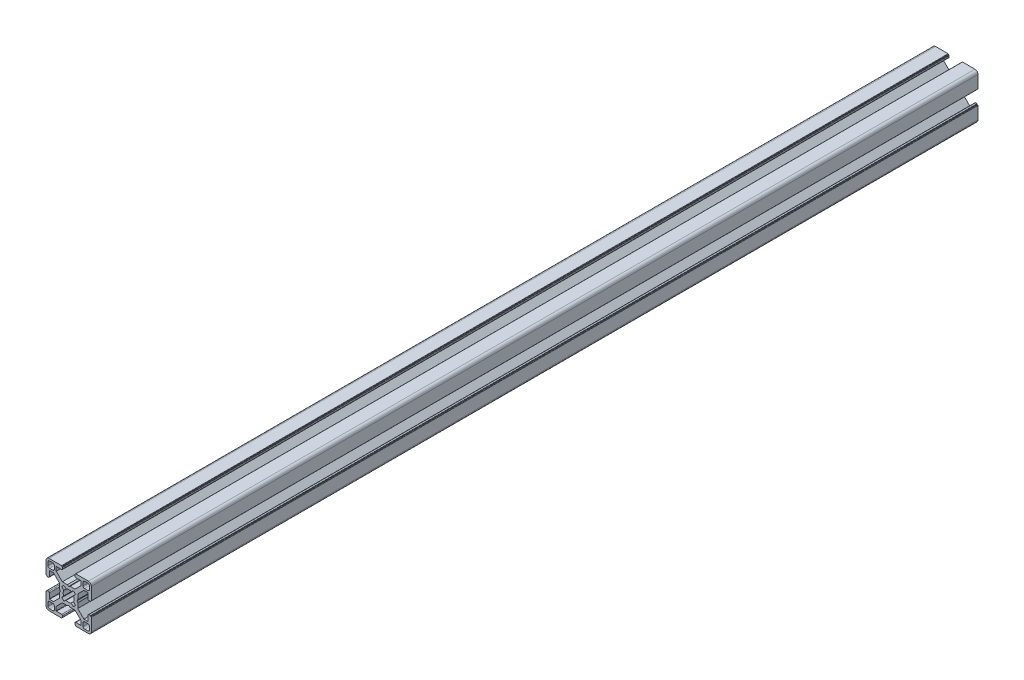
from build123d import *

# Parameters (mm, degrees)
BOSS_EXTRUDE1_DEPTH = 586.105


with BuildPart() as part:
    # Sketch1 → Boss-Extrude1 (new body)
    with BuildSketch(Plane.XY):
        with BuildLine():
            Line((6.00446543, 0.899999619), (5.484852164, 0))
            Line((5.484852164, 0), (6.00446543, -0.899999619))
            Line((6.00446543, -0.899999619), (6.00446543, -4.204465866))
            Line((6.00446543, -4.204465866), (10.049999564, -8.25))
            Line((10.049999564, -8.25), (12.59999928, -8.25))
            ThreePointArc((12.59999928, -8.25), (12.741420837, -8.191421273), (12.799999564, -8.049999716))
            Line((12.799999564, -8.049999716), (12.799999564, -4.649999613))
            ThreePointArc((12.799999564, -4.649999613), (12.975735606, -4.225735278), (13.39999994, -4.049999237))
            Line((13.39999994, -4.049999237), (14.300000043, -4.049999237))
            ThreePointArc((14.300000043, -4.049999237), (14.4414216, -4.108577964), (14.500000327, -4.249999521))
            Line((14.500000327, -4.249999521), (14.500000327, -4.349998953))
            ThreePointArc((14.500000327, -4.349998953), (14.558579054, -4.49142051), (14.700000611, -4.549999237))
            Line((14.700000611, -4.549999237), (14.799999716, -4.549999237))
            ThreePointArc((14.799999716, -4.549999237), (14.941421273, -4.608577964), (15, -4.749999521))
            Line((15, -4.749999521), (15, -13.000000346))
            ThreePointArc((15, -13.000000346), (14.414213664, -14.414213664), (13.000000346, -15))
            Line((13.000000346, -15), (4.749999945, -15))
            ThreePointArc((4.749999945, -15), (4.60857832, -14.941421245), (4.549999564, -14.799999619))
            Line((4.549999564, -14.799999619), (4.549999564, -14.69999942))
            ThreePointArc((4.549999564, -14.69999942), (4.49142109, -14.558578474), (4.350000144, -14.5))
            Line((4.350000144, -14.5), (4.250000374, -14.5))
            ThreePointArc((4.250000374, -14.5), (4.108578753, -14.441421247), (4.05, -14.299999626))
            Line((4.05, -14.299999626), (4.05, -13.399999434))
            ThreePointArc((4.05, -13.399999434), (4.225735989, -12.975735226), (4.650000197, -12.799999237))
            Line((4.650000197, -12.799999237), (8.049999924, -12.799999237))
            ThreePointArc((8.049999924, -12.799999237), (8.191421565, -12.741420475), (8.250000327, -12.599998834))
            Line((8.250000327, -12.599998834), (8.250000327, -10.049999237))
            Line((8.250000327, -10.049999237), (4.204466193, -6))
            Line((4.204466193, -6), (0.899999946, -6))
            Line((0.899999946, -6), (0, -5.484851837))
            Line((0, -5.484851837), (-0.899999946, -6))
            Line((-0.899999946, -6), (-4.204466193, -6))
            Line((-4.204466193, -6), (-8.250000327, -10.049999237))
            Line((-8.250000327, -10.049999237), (-8.250000327, -12.599998834))
            ThreePointArc((-8.250000327, -12.599998834), (-8.191421565, -12.741420475), (-8.049999924, -12.799999237))
            Line((-8.049999924, -12.799999237), (-4.650000197, -12.799999237))
            ThreePointArc((-4.650000197, -12.799999237), (-4.225735989, -12.975735226), (-4.05, -13.399999434))
            Line((-4.05, -13.399999434), (-4.05, -14.299999626))
            ThreePointArc((-4.05, -14.299999626), (-4.108578753, -14.441421247), (-4.250000374, -14.5))
            Line((-4.250000374, -14.5), (-4.350000144, -14.5))
            ThreePointArc((-4.350000144, -14.5), (-4.49142109, -14.558578474), (-4.549999564, -14.69999942))
            Line((-4.549999564, -14.69999942), (-4.549999564, -14.799999619))
            ThreePointArc((-4.549999564, -14.799999619), (-4.60857832, -14.941421245), (-4.749999945, -15))
            Line((-4.749999945, -15), (-13.000000346, -15))
            ThreePointArc((-13.000000346, -15), (-14.414213664, -14.414213664), (-15, -13.000000346))
            Line((-15, -13.000000346), (-15, -4.749999521))
            ThreePointArc((-15, -4.749999521), (-14.941421273, -4.608577964), (-14.799999716, -4.549999237))
            Line((-14.799999716, -4.549999237), (-14.700000611, -4.549999237))
            ThreePointArc((-14.700000611, -4.549999237), (-14.558579054, -4.49142051), (-14.500000327, -4.349998953))
            Line((-14.500000327, -4.349998953), (-14.500000327, -4.249999521))
            ThreePointArc((-14.500000327, -4.249999521), (-14.4414216, -4.108577964), (-14.300000043, -4.049999237))
            Line((-14.300000043, -4.049999237), (-13.39999994, -4.049999237))
            ThreePointArc((-13.39999994, -4.049999237), (-12.975735606, -4.225735278), (-12.799999564, -4.649999613))
            Line((-12.799999564, -4.649999613), (-12.799999564, -8.049999716))
            ThreePointArc((-12.799999564, -8.049999716), (-12.741420837, -8.191421273), (-12.59999928, -8.25))
            Line((-12.59999928, -8.25), (-10.049999564, -8.25))
            Line((-10.049999564, -8.25), (-6.00446543, -4.204465866))
            Line((-6.00446543, -4.204465866), (-6.00446543, -0.899999619))
            Line((-6.00446543, -0.899999619), (-5.484852164, 0))
            Line((-5.484852164, 0), (-6.00446543, 0.899999619))
            Line((-6.00446543, 0.899999619), (-6.00446543, 4.204465866))
            Line((-6.00446543, 4.204465866), (-10.049999564, 8.25))
            Line((-10.049999564, 8.25), (-12.59999928, 8.25))
            ThreePointArc((-12.59999928, 8.25), (-12.741420837, 8.191421273), (-12.799999564, 8.049999716))
            Line((-12.799999564, 8.049999716), (-12.799999564, 4.649999613))
            ThreePointArc((-12.799999564, 4.649999613), (-12.975735606, 4.225735278), (-13.39999994, 4.049999237))
            Line((-13.39999994, 4.049999237), (-14.300000043, 4.049999237))
            ThreePointArc((-14.300000043, 4.049999237), (-14.4414216, 4.108577964), (-14.500000327, 4.249999521))
            Line((-14.500000327, 4.249999521), (-14.500000327, 4.349998953))
            ThreePointArc((-14.500000327, 4.349998953), (-14.558579054, 4.49142051), (-14.700000611, 4.549999237))
            Line((-14.700000611, 4.549999237), (-14.799999716, 4.549999237))
            ThreePointArc((-14.799999716, 4.549999237), (-14.941421273, 4.608577964), (-15, 4.749999521))
            Line((-15, 4.749999521), (-15, 13.000000346))
            ThreePointArc((-15, 13.000000346), (-14.414213664, 14.414213664), (-13.000000346, 15))
            Line((-13.000000346, 15), (-4.749999945, 15))
            ThreePointArc((-4.749999945, 15), (-4.60857832, 14.941421245), (-4.549999564, 14.799999619))
            Line((-4.549999564, 14.799999619), (-4.549999564, 14.69999942))
            ThreePointArc((-4.549999564, 14.69999942), (-4.49142109, 14.558578474), (-4.350000144, 14.5))
            Line((-4.350000144, 14.5), (-4.250000374, 14.5))
            ThreePointArc((-4.250000374, 14.5), (-4.108578753, 14.441421247), (-4.05, 14.299999626))
            Line((-4.05, 14.299999626), (-4.05, 13.399999434))
            ThreePointArc((-4.05, 13.399999434), (-4.225735989, 12.975735226), (-4.650000197, 12.799999237))
            Line((-4.650000197, 12.799999237), (-8.049999924, 12.799999237))
            ThreePointArc((-8.049999924, 12.799999237), (-8.191421565, 12.741420475), (-8.250000327, 12.599998834))
            Line((-8.250000327, 12.599998834), (-8.250000327, 10.049999237))
            Line((-8.250000327, 10.049999237), (-4.204466193, 6))
            Line((-4.204466193, 6), (-0.899999946, 6))
            Line((-0.899999946, 6), (0, 5.484851837))
            Line((0, 5.484851837), (0.899999946, 6))
            Line((0.899999946, 6), (4.204466193, 6))
            Line((4.204466193, 6), (8.250000327, 10.049999237))
            Line((8.250000327, 10.049999237), (8.250000327, 12.599998834))
            ThreePointArc((8.250000327, 12.599998834), (8.191421565, 12.741420475), (8.049999924, 12.799999237))
            Line((8.049999924, 12.799999237), (4.650000197, 12.799999237))
            ThreePointArc((4.650000197, 12.799999237), (4.225735989, 12.975735226), (4.05, 13.399999434))
            Line((4.05, 13.399999434), (4.05, 14.299999626))
            ThreePointArc((4.05, 14.299999626), (4.108578753, 14.441421247), (4.250000374, 14.5))
            Line((4.250000374, 14.5), (4.350000144, 14.5))
            ThreePointArc((4.350000144, 14.5), (4.49142109, 14.558578474), (4.549999564, 14.69999942))
            Line((4.549999564, 14.69999942), (4.549999564, 14.799999619))
            ThreePointArc((4.549999564, 14.799999619), (4.60857832, 14.941421245), (4.749999945, 15))
            Line((4.749999945, 15), (13.000000346, 15))
            ThreePointArc((13.000000346, 15), (14.414213664, 14.414213664), (15, 13.000000346))
            Line((15, 13.000000346), (15, 4.749999521))
            ThreePointArc((15, 4.749999521), (14.941421273, 4.608577964), (14.799999716, 4.549999237))
            Line((14.799999716, 4.549999237), (14.700000611, 4.549999237))
            ThreePointArc((14.700000611, 4.549999237), (14.558579054, 4.49142051), (14.500000327, 4.349998953))
            Line((14.500000327, 4.349998953), (14.500000327, 4.249999521))
            ThreePointArc((14.500000327, 4.249999521), (14.4414216, 4.108577964), (14.300000043, 4.049999237))
            Line((14.300000043, 4.049999237), (13.39999994, 4.049999237))
            ThreePointArc((13.39999994, 4.049999237), (12.975735606, 4.225735278), (12.799999564, 4.649999613))
            Line((12.799999564, 4.649999613), (12.799999564, 8.049999716))
            ThreePointArc((12.799999564, 8.049999716), (12.741420837, 8.191421273), (12.59999928, 8.25))
            Line((12.59999928, 8.25), (10.049999564, 8.25))
            Line((10.049999564, 8.25), (6.00446543, 4.204465866))
            Line((6.00446543, 4.204465866), (6.00446543, 0.899999619))
        make_face()
        with BuildLine():
            Line((13.70000109, 12.700000398), (13.70000109, 10.499999635))
            ThreePointArc((13.70000109, 10.499999635), (13.407107874, 9.792892851), (12.70000109, 9.499999635))
            Line((12.70000109, 9.499999635), (10.500000327, 9.499999635))
            ThreePointArc((10.500000327, 9.499999635), (9.792893543, 9.792892851), (9.500000327, 10.499999635))
            Line((9.500000327, 10.499999635), (9.500000327, 12.700000398))
            ThreePointArc((9.500000327, 12.700000398), (9.792893543, 13.407107182), (10.500000327, 13.700000398))
            Line((10.500000327, 13.700000398), (12.70000109, 13.700000398))
            ThreePointArc((12.70000109, 13.700000398), (13.407107874, 13.407107182), (13.70000109, 12.700000398))
        make_face(mode=Mode.SUBTRACT)
        with BuildLine():
            Line((3.135929412, 4.518400903), (1.600129524, 3.280561767))
            ThreePointArc((1.600129524, 3.280561767), (0, 3.65), (-1.600129524, 3.280561767))
            Line((-1.600129524, 3.280561767), (-3.135929412, 4.518400903))
            ThreePointArc((-3.135929412, 4.518400903), (-3.881002259, 3.897155561), (-4.505336892, 3.154669473))
            Line((-4.505336892, 3.154669473), (-3.280561732, 1.600129597))
            ThreePointArc((-3.280561732, 1.600129597), (-3.65, 0), (-3.280561732, -1.600129597))
            Line((-3.280561732, -1.600129597), (-4.505336892, -3.154669473))
            ThreePointArc((-4.505336892, -3.154669473), (-3.881002259, -3.897155561), (-3.135929412, -4.518400903))
            Line((-3.135929412, -4.518400903), (-1.600129524, -3.280561767))
            ThreePointArc((-1.600129524, -3.280561767), (0, -3.65), (1.600129524, -3.280561767))
            Line((1.600129524, -3.280561767), (3.135929412, -4.518400903))
            ThreePointArc((3.135929412, -4.518400903), (3.881002259, -3.897155561), (4.505336892, -3.154669473))
            Line((4.505336892, -3.154669473), (3.280561732, -1.600129597))
            ThreePointArc((3.280561732, -1.600129597), (3.65, 0), (3.280561732, 1.600129597))
            Line((3.280561732, 1.600129597), (4.505336892, 3.154669473))
            ThreePointArc((4.505336892, 3.154669473), (3.881002259, 3.897155561), (3.135929412, 4.518400903))
        make_face(mode=Mode.SUBTRACT)
        with BuildLine():
            Line((-13.70000109, -12.700000398), (-13.70000109, -10.499999635))
            ThreePointArc((-13.70000109, -10.499999635), (-13.407107874, -9.792892851), (-12.70000109, -9.499999635))
            Line((-12.70000109, -9.499999635), (-10.500000327, -9.499999635))
            ThreePointArc((-10.500000327, -9.499999635), (-9.792893543, -9.792892851), (-9.500000327, -10.499999635))
            Line((-9.500000327, -10.499999635), (-9.500000327, -12.700000398))
            ThreePointArc((-9.500000327, -12.700000398), (-9.792893543, -13.407107182), (-10.500000327, -13.700000398))
            Line((-10.500000327, -13.700000398), (-12.70000109, -13.700000398))
            ThreePointArc((-12.70000109, -13.700000398), (-13.407107874, -13.407107182), (-13.70000109, -12.700000398))
        make_face(mode=Mode.SUBTRACT)
        with BuildLine():
            Line((10.500000327, -13.700000398), (12.70000109, -13.700000398))
            ThreePointArc((12.70000109, -13.700000398), (13.407107874, -13.407107182), (13.70000109, -12.700000398))
            Line((13.70000109, -12.700000398), (13.70000109, -10.499999635))
            ThreePointArc((13.70000109, -10.499999635), (13.407107874, -9.792892851), (12.70000109, -9.499999635))
            Line((12.70000109, -9.499999635), (10.500000327, -9.499999635))
            ThreePointArc((10.500000327, -9.499999635), (9.792893543, -9.792892851), (9.500000327, -10.499999635))
            Line((9.500000327, -10.499999635), (9.500000327, -12.700000398))
            ThreePointArc((9.500000327, -12.700000398), (9.792893543, -13.407107182), (10.500000327, -13.700000398))
        make_face(mode=Mode.SUBTRACT)
        with BuildLine():
            Line((-10.500000327, 13.700000398), (-12.70000109, 13.700000398))
            ThreePointArc((-12.70000109, 13.700000398), (-13.407107874, 13.407107182), (-13.70000109, 12.700000398))
            Line((-13.70000109, 12.700000398), (-13.70000109, 10.499999635))
            ThreePointArc((-13.70000109, 10.499999635), (-13.407107874, 9.792892851), (-12.70000109, 9.499999635))
            Line((-12.70000109, 9.499999635), (-10.500000327, 9.499999635))
            ThreePointArc((-10.500000327, 9.499999635), (-9.792893543, 9.792892851), (-9.500000327, 10.499999635))
            Line((-9.500000327, 10.499999635), (-9.500000327, 12.700000398))
            ThreePointArc((-9.500000327, 12.700000398), (-9.792893543, 13.407107182), (-10.500000327, 13.700000398))
        make_face(mode=Mode.SUBTRACT)
    extrude(amount=BOSS_EXTRUDE1_DEPTH)


solid = part.part
